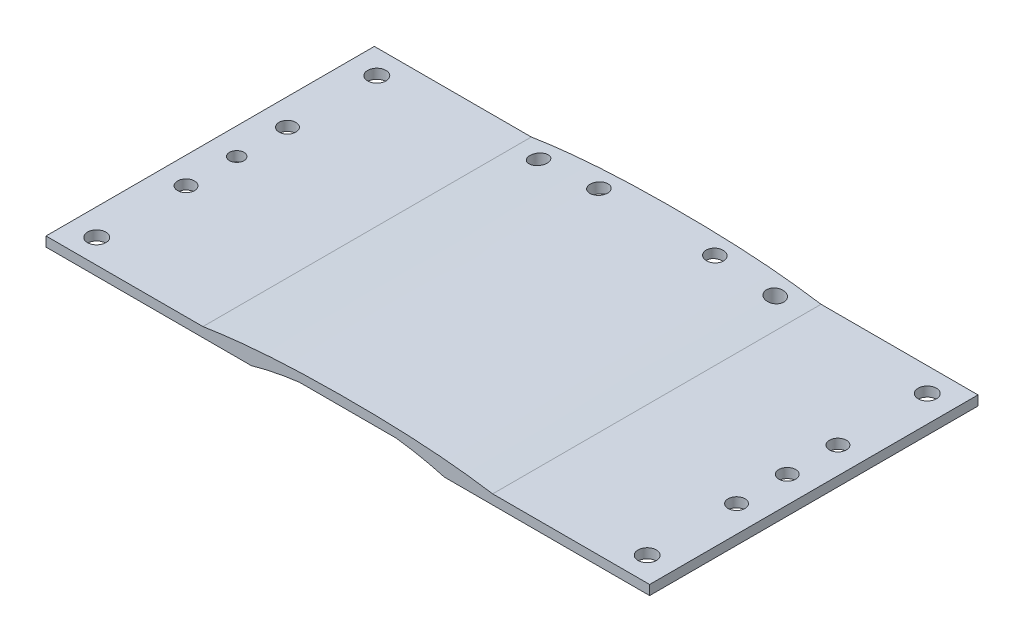
from build123d import *

# Parameters (mm, degrees)
SKETCH_1_W          = 125
SKETCH_1_H          = 68
SKETCH_1_R          = 1.5
SKETCH_1_R_2        = 1.75
SKETCH_1_R_3        = 1.9
EXTRUDE_1_DEPTH     = 2
EXTRUDE_2_DEPTH     = 68
SKETCH_4_W          = 20
SKETCH_4_H          = 2
CUT_EXTRUDE_1_DEPTH = 68
SKETCH_5_R          = 1.8
CUT_EXTRUDE_2_DEPTH = 10


with BuildPart() as part:
    # 草图1 → 凸台-拉伸1 (new body)
    with BuildSketch(Plane(origin=(0, 0, 0), x_dir=(1, 0, 0), z_dir=(0, 1, 0))):
        Rectangle(SKETCH_1_W, SKETCH_1_H)
        with Locations(Location((-57, 0, 0), (0, 0, 270))):
            Circle(SKETCH_1_R, mode=Mode.SUBTRACT)
        with Locations(Location((57, 0, 0), (0, 0, 270))):
            Circle(SKETCH_1_R_2, mode=Mode.SUBTRACT)
        with Locations(Location((57, -29, 0), (0, 0, 270))):
            Circle(SKETCH_1_R_3, mode=Mode.SUBTRACT)
        with Locations(Location((57, 29, 0), (0, 0, 270))):
            Circle(SKETCH_1_R_3, mode=Mode.SUBTRACT)
        with Locations(Location((57, 10.5, 0), (0, 0, 270))):
            Circle(SKETCH_1_R_2, mode=Mode.SUBTRACT)
        with Locations(Location((57, -10.5, 0), (0, 0, 270))):
            Circle(SKETCH_1_R_2, mode=Mode.SUBTRACT)
        with Locations(Location((-57, 10.5, 0), (0, 0, 270))):
            Circle(SKETCH_1_R_2, mode=Mode.SUBTRACT)
        with Locations(Location((-57, -10.5, 0), (0, 0, 270))):
            Circle(SKETCH_1_R_2, mode=Mode.SUBTRACT)
        with Locations(Location((-57, 29, 0), (0, 0, 270))):
            Circle(SKETCH_1_R_3, mode=Mode.SUBTRACT)
        with Locations(Location((-57, -29, 0), (0, 0, 270))):
            Circle(SKETCH_1_R_3, mode=Mode.SUBTRACT)
    extrude(amount=EXTRUDE_1_DEPTH)

    # 草图3 → 凸台-拉伸2 (add)
    with BuildSketch(Plane.XY.offset(34)):
        with BuildLine():
            Line((-40, 0), (40, 0))
            add(Edge.make_bspline(
                [(-40, 0), (-26.931059471, 3.210455026), (0, 4.789544974), (26.931059471, 3.210455026), (40, 0)],
                knots=[0, 0, 0, 0, 0.5, 1, 1, 1, 1], degree=3))
        make_face()
    extrude(amount=-EXTRUDE_2_DEPTH)

    # 草图4 → 切除-拉伸1 (cut)
    with BuildSketch(Plane.XY.offset(34)):
        with Locations((0, 1)):
            Rectangle(SKETCH_4_W, SKETCH_4_H)
        with BuildLine():
            Line((-10, 0), (-10, 2))
            add(Edge.make_bspline(
                [(-20, 0), (-15.076813979, 1.384660804), (-10, 2)],
                knots=[0, 0, 0, 1, 1, 1], degree=2))
            Line((-20, 0), (-10, 0))
        make_face()
        with BuildLine():
            add(Edge.make_bspline(
                [(10, 2), (15.076813979, 1.384660804), (20, 0)],
                knots=[0, 0, 0, 1, 1, 1], degree=2))
            Line((10, 2), (10, 0))
            Line((10, 0), (20, 0))
        make_face()
    extrude(amount=-CUT_EXTRUDE_1_DEPTH, mode=Mode.SUBTRACT)

    # 草图5 → 切除-拉伸2 (cut)
    with BuildSketch(Plane(origin=(0, 0, 0), x_dir=(1, 0, 0), z_dir=(0, 1, 0))):
        with Locations(Location((-24.5, 30, 0), (0, 0, 90))):
            Circle(SKETCH_5_R)
        with Locations(Location((-12, 30, 0), (0, 0, 90))):
            Circle(SKETCH_5_R)
        with Locations(Location((12, 30, 0), (0, 0, 90))):
            Circle(SKETCH_5_R)
        with Locations(Location((24.5, 30, 0), (0, 0, 90))):
            Circle(SKETCH_5_R)
    extrude(amount=CUT_EXTRUDE_2_DEPTH, mode=Mode.SUBTRACT)


solid = part.part
